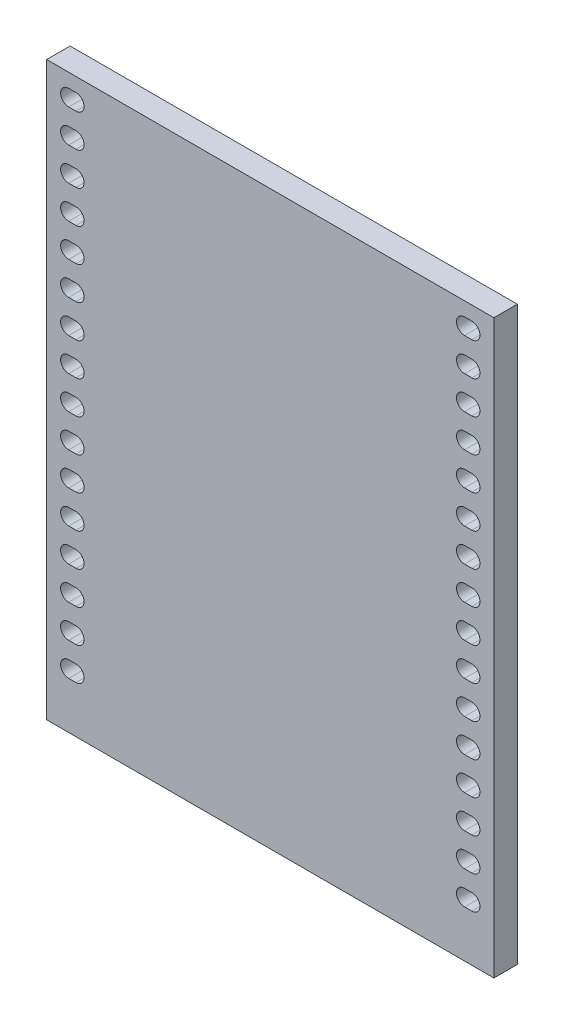
from build123d import *

# Parameters (mm, degrees)
SKETCH1_W                 = 305
SKETCH1_H                 = 390
BOSS_EXTRUDE1_DEPTH       = 16
CUT_EXTRUDE4_DEPTH        = 420.061153055
LPATTERN1_COUNT           = 16
LPATTERN1_PITCH           = 22.5
F_8_36_TAPPED_HOLE1_D     = 3.4544
F_8_36_TAPPED_HOLE1_DEPTH = 25
F_8_36_TAPPED_HOLE1_TIP   = 1.037806461
MIRROR1_COPY_1_DEPTH      = 420.061153055
MIRROR1_COPY_2_DEPTH      = 420.061153055
MIRROR1_COPY_3_DEPTH      = 420.061153055
MIRROR1_COPY_4_DEPTH      = 420.061153055
MIRROR1_COPY_5_DEPTH      = 420.061153055
MIRROR1_COPY_6_DEPTH      = 420.061153055
MIRROR1_COPY_7_DEPTH      = 420.061153055
MIRROR1_COPY_8_DEPTH      = 420.061153055
MIRROR1_COPY_9_DEPTH      = 420.061153055
MIRROR1_COPY_10_DEPTH     = 420.061153055
MIRROR1_COPY_11_DEPTH     = 420.061153055
MIRROR1_COPY_12_DEPTH     = 420.061153055
MIRROR1_COPY_13_DEPTH     = 420.061153055
MIRROR1_COPY_14_DEPTH     = 420.061153055
MIRROR1_COPY_15_DEPTH     = 420.061153055


with BuildPart() as part:
    # Sketch1 → Boss-Extrude1 (new body)
    with BuildSketch(Plane.XY):
        with Locations((0, 195)):
            Rectangle(SKETCH1_W, SKETCH1_H)
    extrude(amount=BOSS_EXTRUDE1_DEPTH)

    # Sketch2 → Cut-Extrude4 (cut, through all)
    with BuildSketch(Plane.XY.offset(16)):
        with BuildLine():
            Line((137.5, 32), (132.5, 32))
            ThreePointArc((132.5, 32), (127, 37.5), (132.5, 43))
            Line((132.5, 43), (137.5, 43))
            ThreePointArc((137.5, 43), (143, 37.5), (137.5, 32))
        make_face()
    cut_extrude4 = extrude(amount=-CUT_EXTRUDE4_DEPTH, mode=Mode.SUBTRACT)

    # LPattern1: Cut-Extrude4 ×16
    with Locations(*[(0, i * LPATTERN1_PITCH, 0) for i in range(1, LPATTERN1_COUNT)]):
        add(cut_extrude4, mode=Mode.SUBTRACT)

    # #8-36 Tapped Hole1
    with Locations(Plane(origin=(0, 0, 0), x_dir=(-1, 0, 0), z_dir=(0, -1, 0))):
        with Locations((-125, -8), (0, -8), (125, -8)):
            Hole(F_8_36_TAPPED_HOLE1_D / 2, depth=F_8_36_TAPPED_HOLE1_DEPTH)
            with Locations((0, 0, -(F_8_36_TAPPED_HOLE1_DEPTH + F_8_36_TAPPED_HOLE1_TIP / 2))):  # 118° drill point
                Cone(0, F_8_36_TAPPED_HOLE1_D / 2, F_8_36_TAPPED_HOLE1_TIP, mode=Mode.SUBTRACT)

    # Mirror1: Cut-Extrude4 across plane
    add(cut_extrude4.mirror(Plane(origin=(0, 0, 0), x_dir=(0, 0, 1), z_dir=(1, 0, 0))), mode=Mode.SUBTRACT)

    # Mirror1 copy 1 sketch → Mirror1 copy 1 (cut, through all)
    with BuildSketch(Plane(origin=(0, 22.5, 16), x_dir=(-1, 0, 0), z_dir=(0, 0, 1))):
        with BuildLine():
            Line((137.5, -32), (132.5, -32))
            ThreePointArc((132.5, -32), (127, -37.5), (132.5, -43))
            Line((132.5, -43), (137.5, -43))
            ThreePointArc((137.5, -43), (143, -37.5), (137.5, -32))
        make_face()
    extrude(amount=-MIRROR1_COPY_1_DEPTH, mode=Mode.SUBTRACT)

    # Mirror1 copy 2 sketch → Mirror1 copy 2 (cut, through all)
    with BuildSketch(Plane(origin=(0, 45, 16), x_dir=(-1, 0, 0), z_dir=(0, 0, 1))):
        with BuildLine():
            Line((137.5, -32), (132.5, -32))
            ThreePointArc((132.5, -32), (127, -37.5), (132.5, -43))
            Line((132.5, -43), (137.5, -43))
            ThreePointArc((137.5, -43), (143, -37.5), (137.5, -32))
        make_face()
    extrude(amount=-MIRROR1_COPY_2_DEPTH, mode=Mode.SUBTRACT)

    # Mirror1 copy 3 sketch → Mirror1 copy 3 (cut, through all)
    with BuildSketch(Plane(origin=(0, 67.5, 16), x_dir=(-1, 0, 0), z_dir=(0, 0, 1))):
        with BuildLine():
            Line((137.5, -32), (132.5, -32))
            ThreePointArc((132.5, -32), (127, -37.5), (132.5, -43))
            Line((132.5, -43), (137.5, -43))
            ThreePointArc((137.5, -43), (143, -37.5), (137.5, -32))
        make_face()
    extrude(amount=-MIRROR1_COPY_3_DEPTH, mode=Mode.SUBTRACT)

    # Mirror1 copy 4 sketch → Mirror1 copy 4 (cut, through all)
    with BuildSketch(Plane(origin=(0, 90, 16), x_dir=(-1, 0, 0), z_dir=(0, 0, 1))):
        with BuildLine():
            Line((137.5, -32), (132.5, -32))
            ThreePointArc((132.5, -32), (127, -37.5), (132.5, -43))
            Line((132.5, -43), (137.5, -43))
            ThreePointArc((137.5, -43), (143, -37.5), (137.5, -32))
        make_face()
    extrude(amount=-MIRROR1_COPY_4_DEPTH, mode=Mode.SUBTRACT)

    # Mirror1 copy 5 sketch → Mirror1 copy 5 (cut, through all)
    with BuildSketch(Plane(origin=(0, 112.5, 16), x_dir=(-1, 0, 0), z_dir=(0, 0, 1))):
        with BuildLine():
            Line((137.5, -32), (132.5, -32))
            ThreePointArc((132.5, -32), (127, -37.5), (132.5, -43))
            Line((132.5, -43), (137.5, -43))
            ThreePointArc((137.5, -43), (143, -37.5), (137.5, -32))
        make_face()
    extrude(amount=-MIRROR1_COPY_5_DEPTH, mode=Mode.SUBTRACT)

    # Mirror1 copy 6 sketch → Mirror1 copy 6 (cut, through all)
    with BuildSketch(Plane(origin=(0, 135, 16), x_dir=(-1, 0, 0), z_dir=(0, 0, 1))):
        with BuildLine():
            Line((137.5, -32), (132.5, -32))
            ThreePointArc((132.5, -32), (127, -37.5), (132.5, -43))
            Line((132.5, -43), (137.5, -43))
            ThreePointArc((137.5, -43), (143, -37.5), (137.5, -32))
        make_face()
    extrude(amount=-MIRROR1_COPY_6_DEPTH, mode=Mode.SUBTRACT)

    # Mirror1 copy 7 sketch → Mirror1 copy 7 (cut, through all)
    with BuildSketch(Plane(origin=(0, 157.5, 16), x_dir=(-1, 0, 0), z_dir=(0, 0, 1))):
        with BuildLine():
            Line((137.5, -32), (132.5, -32))
            ThreePointArc((132.5, -32), (127, -37.5), (132.5, -43))
            Line((132.5, -43), (137.5, -43))
            ThreePointArc((137.5, -43), (143, -37.5), (137.5, -32))
        make_face()
    extrude(amount=-MIRROR1_COPY_7_DEPTH, mode=Mode.SUBTRACT)

    # Mirror1 copy 8 sketch → Mirror1 copy 8 (cut, through all)
    with BuildSketch(Plane(origin=(0, 180, 16), x_dir=(-1, 0, 0), z_dir=(0, 0, 1))):
        with BuildLine():
            Line((137.5, -32), (132.5, -32))
            ThreePointArc((132.5, -32), (127, -37.5), (132.5, -43))
            Line((132.5, -43), (137.5, -43))
            ThreePointArc((137.5, -43), (143, -37.5), (137.5, -32))
        make_face()
    extrude(amount=-MIRROR1_COPY_8_DEPTH, mode=Mode.SUBTRACT)

    # Mirror1 copy 9 sketch → Mirror1 copy 9 (cut, through all)
    with BuildSketch(Plane(origin=(0, 202.5, 16), x_dir=(-1, 0, 0), z_dir=(0, 0, 1))):
        with BuildLine():
            Line((137.5, -32), (132.5, -32))
            ThreePointArc((132.5, -32), (127, -37.5), (132.5, -43))
            Line((132.5, -43), (137.5, -43))
            ThreePointArc((137.5, -43), (143, -37.5), (137.5, -32))
        make_face()
    extrude(amount=-MIRROR1_COPY_9_DEPTH, mode=Mode.SUBTRACT)

    # Mirror1 copy 10 sketch → Mirror1 copy 10 (cut, through all)
    with BuildSketch(Plane(origin=(0, 225, 16), x_dir=(-1, 0, 0), z_dir=(0, 0, 1))):
        with BuildLine():
            Line((137.5, -32), (132.5, -32))
            ThreePointArc((132.5, -32), (127, -37.5), (132.5, -43))
            Line((132.5, -43), (137.5, -43))
            ThreePointArc((137.5, -43), (143, -37.5), (137.5, -32))
        make_face()
    extrude(amount=-MIRROR1_COPY_10_DEPTH, mode=Mode.SUBTRACT)

    # Mirror1 copy 11 sketch → Mirror1 copy 11 (cut, through all)
    with BuildSketch(Plane(origin=(0, 247.5, 16), x_dir=(-1, 0, 0), z_dir=(0, 0, 1))):
        with BuildLine():
            Line((137.5, -32), (132.5, -32))
            ThreePointArc((132.5, -32), (127, -37.5), (132.5, -43))
            Line((132.5, -43), (137.5, -43))
            ThreePointArc((137.5, -43), (143, -37.5), (137.5, -32))
        make_face()
    extrude(amount=-MIRROR1_COPY_11_DEPTH, mode=Mode.SUBTRACT)

    # Mirror1 copy 12 sketch → Mirror1 copy 12 (cut, through all)
    with BuildSketch(Plane(origin=(0, 270, 16), x_dir=(-1, 0, 0), z_dir=(0, 0, 1))):
        with BuildLine():
            Line((137.5, -32), (132.5, -32))
            ThreePointArc((132.5, -32), (127, -37.5), (132.5, -43))
            Line((132.5, -43), (137.5, -43))
            ThreePointArc((137.5, -43), (143, -37.5), (137.5, -32))
        make_face()
    extrude(amount=-MIRROR1_COPY_12_DEPTH, mode=Mode.SUBTRACT)

    # Mirror1 copy 13 sketch → Mirror1 copy 13 (cut, through all)
    with BuildSketch(Plane(origin=(0, 292.5, 16), x_dir=(-1, 0, 0), z_dir=(0, 0, 1))):
        with BuildLine():
            Line((137.5, -32), (132.5, -32))
            ThreePointArc((132.5, -32), (127, -37.5), (132.5, -43))
            Line((132.5, -43), (137.5, -43))
            ThreePointArc((137.5, -43), (143, -37.5), (137.5, -32))
        make_face()
    extrude(amount=-MIRROR1_COPY_13_DEPTH, mode=Mode.SUBTRACT)

    # Mirror1 copy 14 sketch → Mirror1 copy 14 (cut, through all)
    with BuildSketch(Plane(origin=(0, 315, 16), x_dir=(-1, 0, 0), z_dir=(0, 0, 1))):
        with BuildLine():
            Line((137.5, -32), (132.5, -32))
            ThreePointArc((132.5, -32), (127, -37.5), (132.5, -43))
            Line((132.5, -43), (137.5, -43))
            ThreePointArc((137.5, -43), (143, -37.5), (137.5, -32))
        make_face()
    extrude(amount=-MIRROR1_COPY_14_DEPTH, mode=Mode.SUBTRACT)

    # Mirror1 copy 15 sketch → Mirror1 copy 15 (cut, through all)
    with BuildSketch(Plane(origin=(0, 337.5, 16), x_dir=(-1, 0, 0), z_dir=(0, 0, 1))):
        with BuildLine():
            Line((137.5, -32), (132.5, -32))
            ThreePointArc((132.5, -32), (127, -37.5), (132.5, -43))
            Line((132.5, -43), (137.5, -43))
            ThreePointArc((137.5, -43), (143, -37.5), (137.5, -32))
        make_face()
    extrude(amount=-MIRROR1_COPY_15_DEPTH, mode=Mode.SUBTRACT)


solid = part.part
